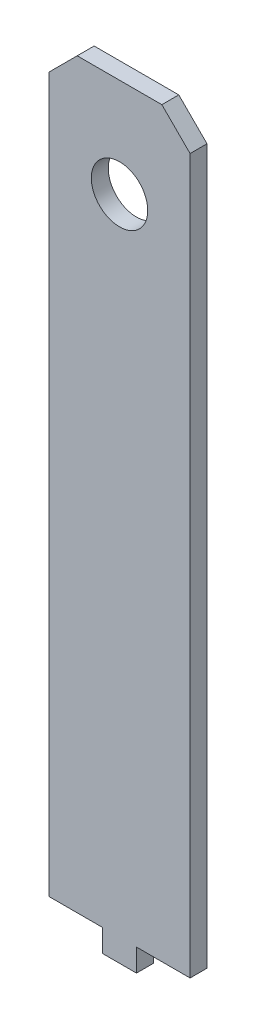
from build123d import *

# Parameters (mm, degrees)
SKETCH1_W           = 25
SKETCH1_H           = 135.5
BOSS_EXTRUDE1_DEPTH = 1.5
SKETCH2_R           = 5
CUT_EXTRUDE1_DEPTH  = 137.108412672
CHAMFER1_SIZE       = 5
SKETCH3_W           = 9.5
SKETCH3_H           = 4
CUT_EXTRUDE2_DEPTH  = 137.108412672


with BuildPart() as part:
    # Sketch1 → Boss-Extrude1 (new, symmetric)
    with BuildSketch(Plane.XY):
        with Locations((0, 67.75)):
            Rectangle(SKETCH1_W, SKETCH1_H)
    extrude(amount=BOSS_EXTRUDE1_DEPTH, both=True)

    # Sketch2 → Cut-Extrude1 (cut, through all)
    with BuildSketch(Plane.XY.offset(1.5)):
        with Locations((0, 118)):
            Circle(SKETCH2_R)
    extrude(amount=-CUT_EXTRUDE1_DEPTH, mode=Mode.SUBTRACT)

    # Chamfer1
    chamfer1_edges = [part.edges().sort_by_distance(p)[0] for p in [
        (-12.5, 135.5, 0),
        (12.5, 135.5, 0),
    ]]
    chamfer(chamfer1_edges, length=CHAMFER1_SIZE)

    # Sketch3 → Cut-Extrude2 (cut, through all)
    with BuildSketch(Plane.XY.offset(1.5)):
        with Locations((-7.75, 2)):
            Rectangle(SKETCH3_W, SKETCH3_H)
        with Locations((7.75, 2)):
            Rectangle(SKETCH3_W, SKETCH3_H)
    extrude(amount=-CUT_EXTRUDE2_DEPTH, mode=Mode.SUBTRACT)


solid = part.part
